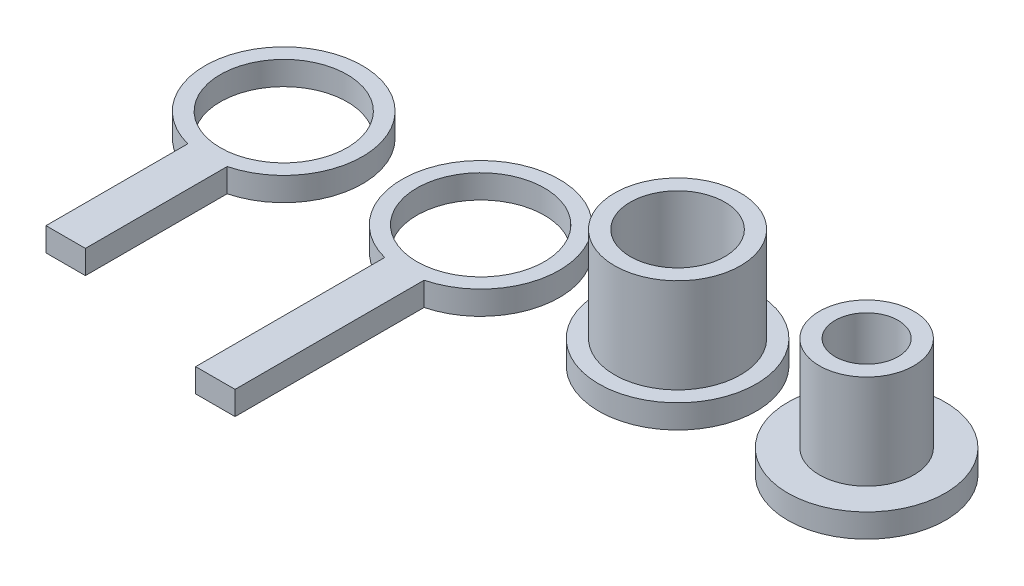
from build123d import *

# Parameters (mm, degrees)
SKETCH_1_R          = 10
EXTRUDE_1_DEPTH     = 3
EXTRUDE_1_2_DEPTH   = 3
SKETCH_4_R          = 6
EXTRUDE_2_DEPTH     = 12
SKETCH_3_R          = 8
EXTRUDE_3_DEPTH     = 12
SKETCH_5_R          = 8.05
EXTRUDE_4_DEPTH     = 3
SKETCH_5_R_2        = 8.1
EXTRUDE_4_2_DEPTH   = 3
SKETCH_10_R         = 6
CUT_EXTRUDE_1_DEPTH = 71.423774406
SKETCH_11_R         = 4
CUT_EXTRUDE_2_DEPTH = 71.423774406


with BuildPart() as part:
    # Эскиз1 → Бобышка-Вытянуть1 (new body)
    with BuildSketch(Plane(origin=(0, 0, 0), x_dir=(1, 0, 0), z_dir=(0, 1, 0))):
        with Locations(Location((0, 0, 0), (0, 0, 270))):
            Circle(SKETCH_1_R)
    extrude(amount=EXTRUDE_1_DEPTH)

    # Эскиз3 → Бобышка-Вытянуть3 (add)
    with BuildSketch(Plane(origin=(0, 3, 0), x_dir=(1, 0, 0), z_dir=(0, 1, 0))):
        with Locations(Location((0, 0, 0), (0, 0, 270))):
            Circle(SKETCH_3_R)
    extrude(amount=EXTRUDE_3_DEPTH)

    # Эскиз10 → Вырез-Вытянуть1 (cut, through all)
    with BuildSketch(Plane(origin=(0, 15, 0), x_dir=(1, 0, 0), z_dir=(0, 1, 0))):
        with Locations(Location((0, 0, 0), (0, 0, 270))):
            Circle(SKETCH_10_R)
    extrude(amount=-CUT_EXTRUDE_1_DEPTH, mode=Mode.SUBTRACT)


with BuildPart() as body_2:
    # Эскиз1 → Extrude 1 2 (new body)
    with BuildSketch(Plane(origin=(0, 0, 0), x_dir=(1, 0, 0), z_dir=(0, 1, 0))):
        with Locations(Location((24, 0, 0), (0, 0, 270))):
            Circle(SKETCH_1_R)
    extrude(amount=EXTRUDE_1_2_DEPTH)

    # Эскиз4 → Бобышка-Вытянуть2 (add)
    with BuildSketch(Plane(origin=(0, 3, 0), x_dir=(1, 0, 0), z_dir=(0, 1, 0))):
        with Locations(Location((24, 0, 0), (0, 0, 270))):
            Circle(SKETCH_4_R)
    extrude(amount=EXTRUDE_2_DEPTH)

    # Эскиз11 → Вырез-Вытянуть2 (cut, through all)
    with BuildSketch(Plane(origin=(0, 15, 0), x_dir=(1, 0, 0), z_dir=(0, 1, 0))):
        with Locations(Location((24, 0, 0), (0, 0, 270))):
            Circle(SKETCH_11_R)
    extrude(amount=-CUT_EXTRUDE_2_DEPTH, mode=Mode.SUBTRACT)


with BuildPart() as body_3:
    # Эскиз5 → Бобышка-Вытянуть4 (new body)
    with BuildSketch(Plane(origin=(0, 0, 0), x_dir=(1, 0, 0), z_dir=(0, 1, 0))):
        with BuildLine():
            Line((-52.5, -27.682458366), (-47.5, -27.682458366))
            Line((-47.5, -27.682458366), (-47.5, -9.682458366))
            ThreePointArc((-47.5, -9.682458366), (-50, 10), (-52.5, -9.682458366))
            Line((-52.5, -9.682458366), (-52.5, -27.682458366))
        make_face()
        with Locations(Location((-50, 0, 0), (0, 0, 270))):
            Circle(SKETCH_5_R, mode=Mode.SUBTRACT)
    extrude(amount=EXTRUDE_4_DEPTH)


with BuildPart() as body_4:
    # Эскиз5 → Extrude 4 2 (new body)
    with BuildSketch(Plane(origin=(0, 0, 0), x_dir=(1, 0, 0), z_dir=(0, 1, 0))):
        with BuildLine():
            Line((-27.5, -33.682458366), (-22.5, -33.682458366))
            Line((-22.5, -33.682458366), (-22.5, -9.682458366))
            ThreePointArc((-22.5, -9.682458366), (-25, 10), (-27.5, -9.682458366))
            Line((-27.5, -9.682458366), (-27.5, -33.682458366))
        make_face()
        with Locations(Location((-25, 0, 0), (0, 0, 270))):
            Circle(SKETCH_5_R_2, mode=Mode.SUBTRACT)
    extrude(amount=EXTRUDE_4_2_DEPTH)


solid = Compound([part.part, body_2.part, body_3.part, body_4.part])
